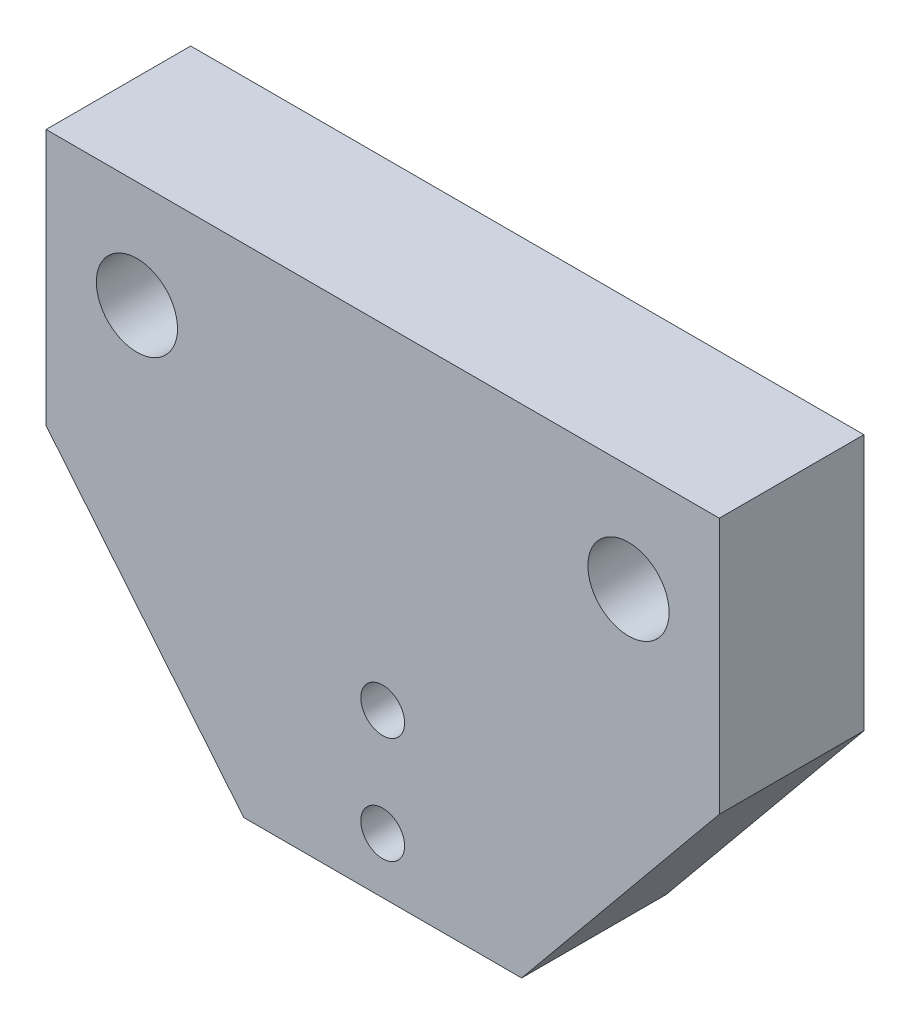
from build123d import *

# Parameters (mm, degrees)
SKETCH1_W           = 63
SKETCH1_H           = 24
SKETCH1_R           = 3.8
BOSS_EXTRUDE1_DEPTH = 13.53
SKETCH1_3_R         = 2.05
BOSS_EXTRUDE2_DEPTH = 13.53


with BuildPart() as part:
    # Sketch1 → Boss-Extrude1 (new body)
    with BuildSketch(Plane.XY):
        with Locations((0, -2)):
            Rectangle(SKETCH1_W, SKETCH1_H)
        with Locations((-23, 0)):
            Circle(SKETCH1_R, mode=Mode.SUBTRACT)
        with Locations((23, 0)):
            Circle(SKETCH1_R, mode=Mode.SUBTRACT)
    extrude(amount=BOSS_EXTRUDE1_DEPTH)

    # Sketch1<3> → Boss-Extrude2 (add)
    with BuildSketch(Plane.XY):
        Polygon((13, -36.51566868), (31.5, -14), (-31.5, -14), (-13, -36.51566868), (0, -36.51566868), align=None)
        with Locations((0, -31.299955557)):
            Circle(SKETCH1_3_R, mode=Mode.SUBTRACT)
        with Locations((0, -21.322069584)):
            Circle(SKETCH1_3_R, mode=Mode.SUBTRACT)
    extrude(amount=BOSS_EXTRUDE2_DEPTH)


solid = part.part
